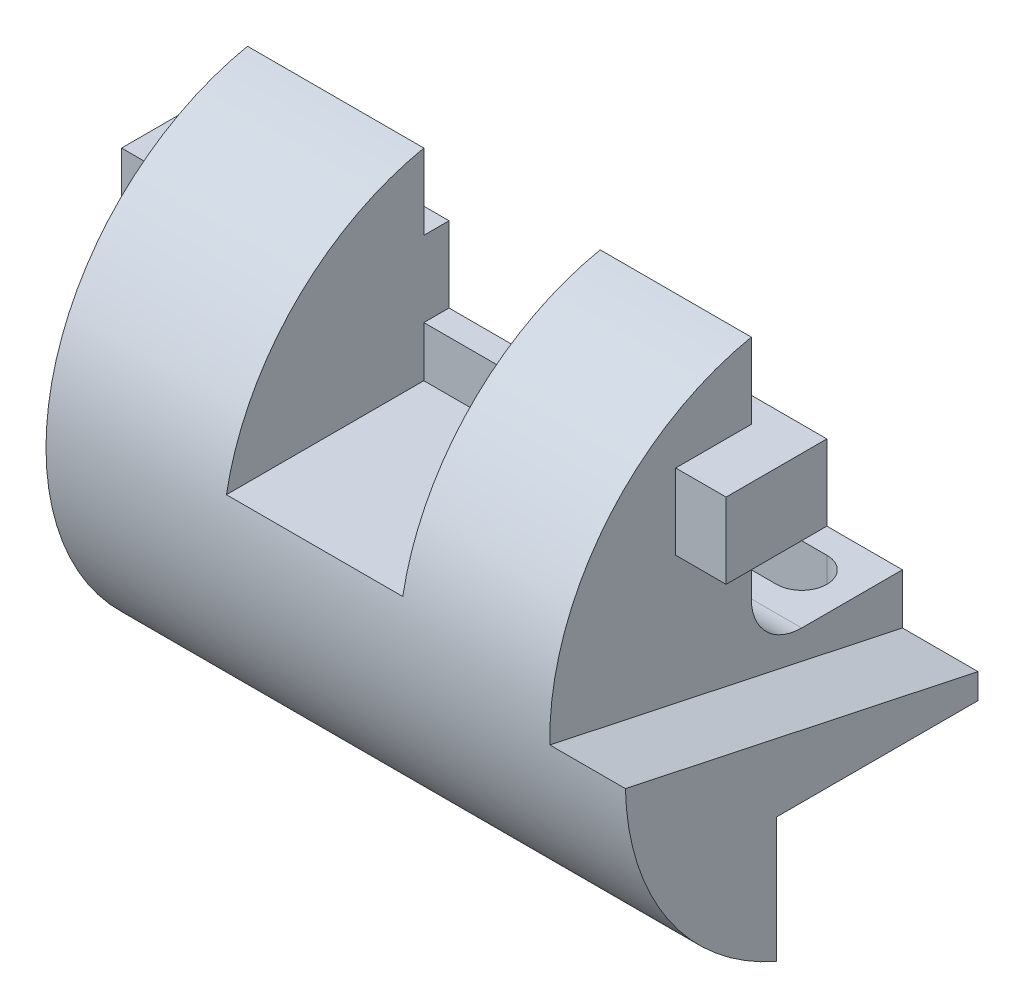
from build123d import *

# Parameters (mm, degrees)
BOSS_EXTRUDE1_DEPTH      = 115
CUT_EXTRUDE3_START       = -15
CUT_EXTRUDE3_DEPTH       = 15
CUT_EXTRUDE4_DEPTH       = 67
SKETCH5_W                = 35
SKETCH5_H                = 40
CUT_EXTRUDE5_DEPTH       = 67
SKETCH6_W                = 40
SKETCH6_H                = 15
BOSS_EXTRUDE2_DEPTH      = 5
SKETCH7_W                = 15
SKETCH7_H                = 15
BOSS_EXTRUDE4_DEPTH      = 10
SKETCH8_W                = 5
SKETCH8_H                = 15
BOSS_EXTRUDE5_DEPTH      = 5
BOSS_EXTRUDE6_DEPTH      = 5
BOSS_EXTRUDE6_DEPTH_BACK = 15
SKETCH9_W                = 40
SKETCH9_H                = 15


with BuildPart() as part:
    # Sketch1 → Boss-Extrude1 (new body)
    with BuildSketch(Plane(origin=(0, 0, 0), x_dir=(0, 0, -1), z_dir=(1, 0, 0))):
        with BuildLine():
            Line((-10, 48.989794856), (-10, 3.989794856))
            ThreePointArc((-10, 3.989794856), (-7.071067812, -3.081272956), (0, -6.010205144))
            Line((0, -6.010205144), (20, -6.010205144))
            Line((20, -6.010205144), (20, -21.010205144))
            Line((20, -21.010205144), (-20, -21.010205144))
            Line((-20, -21.010205144), (-20, -45.82575695))
            ThreePointArc((-20, -45.82575695), (-49.724211568, 5.244309675), (-10, 48.989794856))
        make_face()
    extrude(amount=BOSS_EXTRUDE1_DEPTH)

    # Sketch2 → Cut-Extrude3 (cut)
    with BuildSketch(Plane(origin=(115, 0, 0), x_dir=(0, 0, -1), z_dir=(1, 0, 0)).offset(CUT_EXTRUDE3_START)):
        with BuildLine():
            Line((20, -16.010205144), (-49.987139252, -1.133979464))
            ThreePointArc((-49.987139252, -1.133979464), (-39.085961763, 31.181526471), (-10, 48.989794856))
            Line((-10, 48.989794856), (-10, 3.989794856))
            ThreePointArc((-10, 3.989794856), (-7.071067812, -3.081272956), (0, -6.010205144))
            Line((0, -6.010205144), (20, -6.010205144))
            Line((20, -6.010205144), (20, -16.010205144))
        make_face()
    extrude(amount=CUT_EXTRUDE3_DEPTH, mode=Mode.SUBTRACT)

    # Sketch4 → Cut-Extrude4 (cut)
    with BuildSketch(Plane(origin=(0, -6.010205144, 0), x_dir=(1, 0, 0), z_dir=(0, 1, 0))):
        with BuildLine():
            Line((10, 15), (90, 15))
            ThreePointArc((90, 15), (95, 10), (90, 5))
            Line((90, 5), (10, 5))
            ThreePointArc((10, 5), (5, 10), (10, 15))
        make_face()
    extrude(amount=-CUT_EXTRUDE4_DEPTH, mode=Mode.SUBTRACT)

    # Sketch5 → Cut-Extrude5 (cut)
    with BuildSketch(Plane(origin=(0, 0, 10), x_dir=(-1, 0, 0), z_dir=(0, 0, -1))):
        with Locations((-52.5, 28.989794856)):
            Rectangle(SKETCH5_W, SKETCH5_H)
    extrude(amount=-CUT_EXTRUDE5_DEPTH, mode=Mode.SUBTRACT)

    # Sketch6 → Boss-Extrude2 (add)
    with BuildSketch(Plane(origin=(0, 0, 10), x_dir=(-1, 0, 0), z_dir=(0, 0, -1))):
        with Locations((-15, 26.489794856)):
            Rectangle(SKETCH6_W, SKETCH6_H)
    extrude(amount=BOSS_EXTRUDE2_DEPTH)

    # Sketch7 → Boss-Extrude4 (add)
    with BuildSketch(Plane.ZY):
        with Locations((17.5, 26.489794856)):
            Rectangle(SKETCH7_W, SKETCH7_H)
    extrude(amount=BOSS_EXTRUDE4_DEPTH)

    # Sketch8 → Boss-Extrude5 (add)
    with BuildSketch(Plane(origin=(0, 0, 10), x_dir=(-1, 0, 0), z_dir=(0, 0, -1))):
        with Locations((7.5, 26.489794856)):
            Rectangle(SKETCH8_W, SKETCH8_H)
    extrude(amount=BOSS_EXTRUDE5_DEPTH)

    # Sketch9 → Boss-Extrude6 (add, two sides: drawn at the far end of the back side and taken through both)
    with BuildSketch(Plane(origin=(0, 0, 10), x_dir=(-1, 0, 0), z_dir=(0, 0, -1)).offset(-BOSS_EXTRUDE6_DEPTH_BACK)):
        with Locations((-90, 26.489794856)):
            Rectangle(SKETCH9_W, SKETCH9_H)
    extrude(amount=BOSS_EXTRUDE6_DEPTH + BOSS_EXTRUDE6_DEPTH_BACK)


solid = part.part
